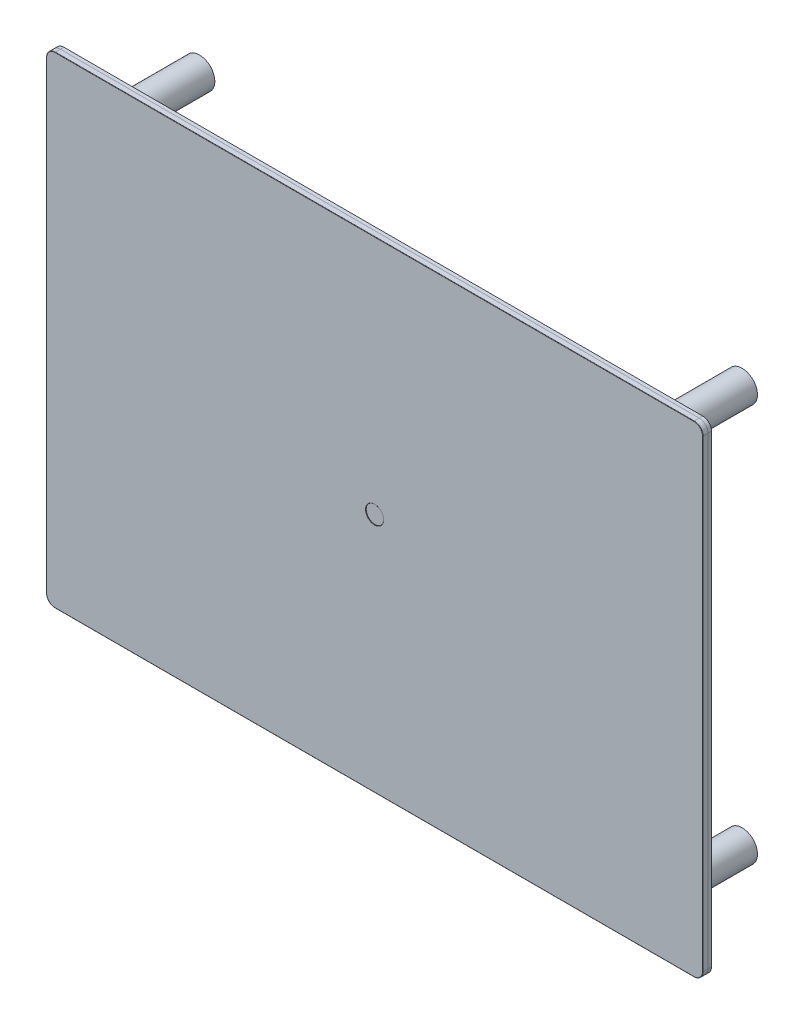
from build123d import *

# Parameters (mm, degrees)
SKETCH1_W               = 750
SKETCH1_H               = 550
BOSS_EXTRUDE1_DEPTH     = 4
SKETCH2_R               = 17.5
BOSS_EXTRUDE2_DEPTH     = 100
MIRROR2_COPY_1_SKETCH_R = 17.5
MIRROR2_COPY_1_DEPTH    = 100
SKETCH3_W               = 600
SKETCH3_H               = 5
BOSS_EXTRUDE3_DEPTH     = 7.5
SKETCH3_W_2             = 5
SKETCH3_H_2             = 430
BOSS_EXTRUDE3_2_DEPTH   = 7.5
SKETCH4_W               = 3.5
SKETCH4_H               = 430
CUT_EXTRUDE1_DEPTH      = 2
SKETCH5_W               = 600
SKETCH5_H               = 3.5
CUT_EXTRUDE2_DEPTH      = 2
SKETCH7_W               = 750
SKETCH7_H               = 550
BOSS_EXTRUDE4_DEPTH     = 6
SKETCH8_R               = 10
CUT_EXTRUDE4_DEPTH      = 0.5
FILLET1_R               = 10
FILLET2_R               = 10
FILLET3_R               = 0.4


with BuildPart() as part:
    # Sketch1 → Boss-Extrude1 (new body)
    with BuildSketch(Plane.XY):
        Rectangle(SKETCH1_W, SKETCH1_H)
    extrude(amount=BOSS_EXTRUDE1_DEPTH)

    # Sketch2 → Boss-Extrude2 (add)
    with BuildSketch(Plane(origin=(0, 0, 0), x_dir=(-1, 0, 0), z_dir=(0, 0, -1))):
        with Locations((310, 227.333333333)):
            Circle(SKETCH2_R)
    boss_extrude2 = extrude(amount=BOSS_EXTRUDE2_DEPTH)

    # Mirror1: Boss-Extrude2 across plane
    add(boss_extrude2.mirror(Plane.ZX))

    # Mirror2: Boss-Extrude2 across plane
    add(boss_extrude2.mirror(Plane(origin=(0, 0, 0), x_dir=(0, 0, 1), z_dir=(1, 0, 0))))

    # Mirror2 copy 1 sketch → Mirror2 copy 1 (add)
    with BuildSketch(Plane(origin=(0, 0, 0), x_dir=(1, 0, 0), z_dir=(0, 0, -1))):
        with Locations((310, 227.333333333)):
            Circle(MIRROR2_COPY_1_SKETCH_R)
    extrude(amount=MIRROR2_COPY_1_DEPTH)

    # Fillet2
    fillet2_edges = [part.edges().sort_by_distance(p)[0] for p in [
        (-375, 275, 2),
        (375, 275, 2),
        (375, -275, 2),
        (-375, -275, 2),
    ]]
    fillet(fillet2_edges, radius=FILLET2_R)


with BuildPart() as body_2:
    # Sketch3 → Boss-Extrude3 (new, symmetric)
    with BuildSketch(Plane(origin=(0, 0, -30), x_dir=(-1, 0, 0), z_dir=(0, 0, -1))):
        with Locations((0, 227.333333333)):
            Rectangle(SKETCH3_W, SKETCH3_H)
    extrude(amount=BOSS_EXTRUDE3_DEPTH, both=True)

    # Sketch5 → Cut-Extrude2 (cut)
    with BuildSketch(Plane(origin=(0, 229.833333333, 0), x_dir=(1, 0, 0), z_dir=(0, 1, 0))):
        with Locations((0, 33.5)):
            Rectangle(SKETCH5_W, SKETCH5_H)
        with Locations((0, 26.5)):
            Rectangle(SKETCH5_W, SKETCH5_H)
    extrude(amount=-CUT_EXTRUDE2_DEPTH, mode=Mode.SUBTRACT)


with BuildPart() as body_3:
    # Sketch3 → Boss-Extrude3 2 (new, symmetric)
    with BuildSketch(Plane(origin=(0, 0, -30), x_dir=(-1, 0, 0), z_dir=(0, 0, -1))):
        with Locations((-310, 0)):
            Rectangle(SKETCH3_W_2, SKETCH3_H_2)
    extrude(amount=BOSS_EXTRUDE3_2_DEPTH, both=True)

    # Sketch4 → Cut-Extrude1 (cut)
    with BuildSketch(Plane(origin=(312.5, 0, 0), x_dir=(0, 0, -1), z_dir=(1, 0, 0))):
        with Locations((33.5, 0)):
            Rectangle(SKETCH4_W, SKETCH4_H)
        with Locations((26.5, 0)):
            Rectangle(SKETCH4_W, SKETCH4_H)
    extrude(amount=-CUT_EXTRUDE1_DEPTH, mode=Mode.SUBTRACT)


with BuildPart() as body_4:
    # Mirror4: mirrored copy
    add(body_2.part.mirror(Plane.ZX))


with BuildPart() as body_5:
    # Mirror5: mirrored copy
    add(body_3.part.mirror(Plane(origin=(0, 0, 0), x_dir=(0, 0, 1), z_dir=(1, 0, 0))))


with BuildPart() as body_6:
    # Sketch7 → Boss-Extrude4 (new body)
    with BuildSketch(Plane.XY.offset(4)):
        Rectangle(SKETCH7_W, SKETCH7_H)
    extrude(amount=BOSS_EXTRUDE4_DEPTH)

    # Sketch8 → Cut-Extrude4 (cut)
    with BuildSketch(Plane.XY.offset(10)):
        Circle(SKETCH8_R)
    extrude(amount=-CUT_EXTRUDE4_DEPTH, mode=Mode.SUBTRACT)

    # Fillet1
    fillet1_edges = [body_6.edges().sort_by_distance(p)[0] for p in [
        (375, 275, 7),
        (375, -275, 7),
        (-375, -275, 7),
        (-375, 275, 7),
    ]]
    fillet(fillet1_edges, radius=FILLET1_R)

    # Fillet3
    fillet3_edges = [body_6.edges().sort_by_distance(p)[0] for p in [
        (-10, 0, 10),
        (-375, 0, 10),
        (0, 275, 10),
        (0, -275, 10),
        (375, 0, 10),
        (372.071067812, 272.071067812, 10),
        (372.071067812, -272.071067812, 10),
        (-372.071067812, -272.071067812, 10),
        (-372.071067812, 272.071067812, 10),
    ]]
    fillet(fillet3_edges, radius=FILLET3_R)


solid = Compound([part.part, body_2.part, body_3.part, body_4.part, body_5.part, body_6.part])
